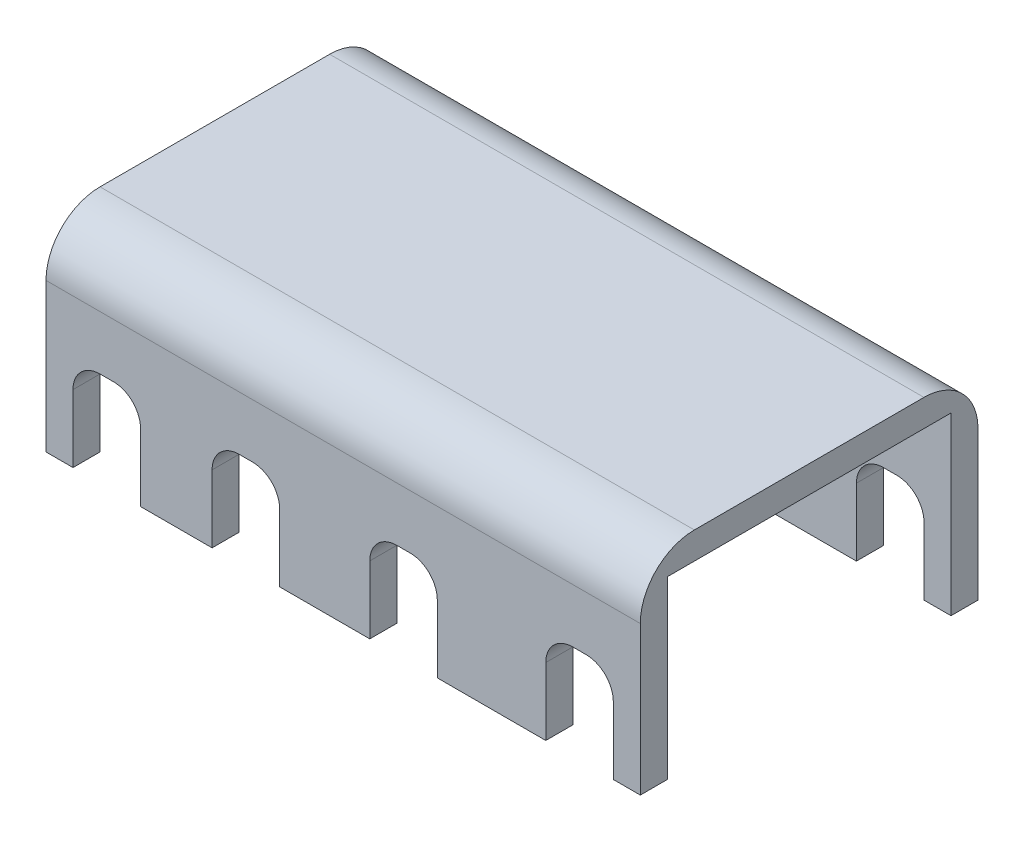
from build123d import *

# Parameters (mm, degrees)
ESBO_O1_W                = 44
ESBO_O1_H                = 25
RESSALTO_EXTRUS_O1_DEPTH = 7.5
CASCA1_T                 = -2
ESBO_O2_W                = 5
ESBO_O2_H                = 14
CORTE_EXTRUS_O1_DEPTH    = 35.135758377
FILETE1_R                = 2
FILETE2_R                = 4


with BuildPart() as part:
    # Esboço1 → Ressalto-extrusão1 (new, symmetric)
    with BuildSketch(Plane(origin=(0, 0, 0), x_dir=(1, 0, 0), z_dir=(0, 1, 0))):
        Rectangle(ESBO_O1_W, ESBO_O1_H)
    extrude(amount=RESSALTO_EXTRUS_O1_DEPTH, both=True)

    # Casca1
    casca1_openings = [part.faces().sort_by_distance(p)[0] for p in [
        (0, -7.5, 0),
        (-22, 0, 0),
        (22, 0, 0),
    ]]
    offset(amount=CASCA1_T, openings=casca1_openings, kind=Kind.INTERSECTION)

    # Esboço2 → Corte-extrusão1 (cut, through all)
    with BuildSketch(Plane.XY.offset(12.5)):
        with Locations((-7.203332481, -7.5)):
            Rectangle(ESBO_O2_W, ESBO_O2_H)
        with Locations((-17.5, -7.5)):
            Rectangle(ESBO_O2_W, ESBO_O2_H)
        with Locations((4.47023527, -7.5)):
            Rectangle(ESBO_O2_W, ESBO_O2_H)
        with Locations((17.5, -7.5)):
            Rectangle(ESBO_O2_W, ESBO_O2_H)
    extrude(amount=-CORTE_EXTRUS_O1_DEPTH, mode=Mode.SUBTRACT)

    # Filete1
    filete1_edges = [part.edges().sort_by_distance(p)[0] for p in [
        (20, -0.5, -11.5),
        (15, -0.5, -11.5),
        (20, -0.5, 11.5),
        (15, -0.5, 11.5),
        (-15, -0.5, -11.5),
        (-20, -0.5, -11.5),
        (-15, -0.5, 11.5),
        (-20, -0.5, 11.5),
        (-4.703332481, -0.5, -11.5),
        (-9.703332481, -0.5, -11.5),
        (-4.703332481, -0.5, 11.5),
        (-9.703332481, -0.5, 11.5),
        (6.97023527, -0.5, -11.5),
        (1.97023527, -0.5, -11.5),
        (6.97023527, -0.5, 11.5),
        (1.97023527, -0.5, 11.5),
    ]]
    fillet(filete1_edges, radius=FILETE1_R)

    # Filete2
    filete2_edges = [part.edges().sort_by_distance(p)[0] for p in [
        (0, 7.5, 12.5),
        (0, 7.5, -12.5),
    ]]
    fillet(filete2_edges, radius=FILETE2_R)


solid = part.part
